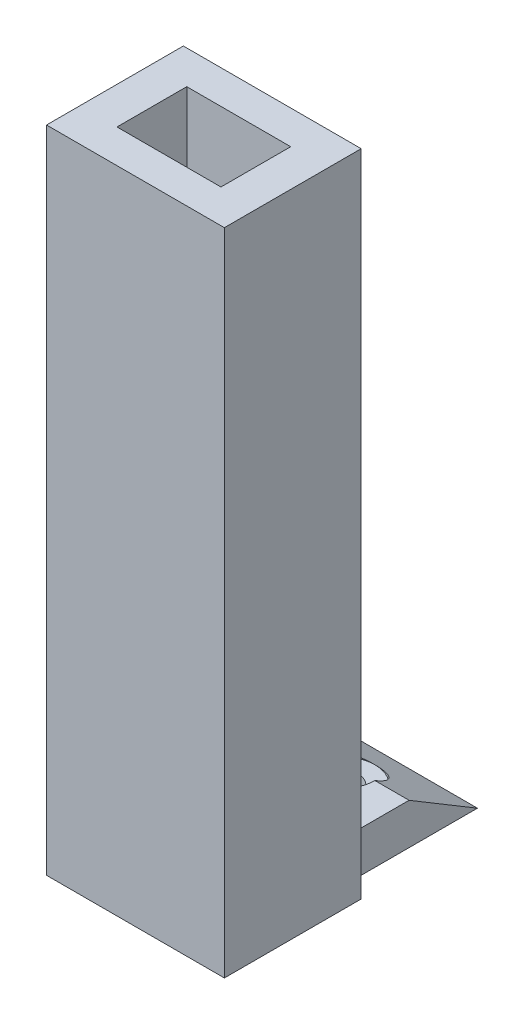
from build123d import *

# Parameters (mm, degrees)
EXTRUDE_1_DEPTH      = 6
SKETCH_2_R           = 2.6
CUT_EXTRUDE_1_DEPTH  = 6
SKETCH_3_R           = 5
CUT_EXTRUDE_2_DEPTH  = 3
SKETCH_4_W           = 26
SKETCH_4_H           = 20
SKETCH_4_W_2         = 15
SKETCH_4_H_2         = 10
EXTRUDE_2_DEPTH      = 89
CUT_EXTRUDE_5_DEPTH  = 5
SKETCH_6_W           = 1
SKETCH_6_H           = 44
EXTRUDE_3_DEPTH      = 15
SKETCH_8_W           = 26
SKETCH_8_H           = 20
SKETCH_8_R           = 2.6
EXTRUDE_4_DEPTH      = 6
SKETCH_9_R           = 5
CUT_EXTRUDE_6_DEPTH  = 3
CUT_EXTRUDE_7_DEPTH  = 30
SKETCH_11_W          = 3
SKETCH_11_H          = 6
CUT_EXTRUDE_8_DEPTH  = 30
CUT_EXTRUDE_10_DEPTH = 45


with BuildPart() as part:
    # 草图1 → 凸台-拉伸1 (new body)
    with BuildSketch(Plane(origin=(0, 0, 0), x_dir=(1, 0, 0), z_dir=(0, 1, 0))):
        Polygon((-10, -10), (10, -10), (13, -10), (13, 10), (10, 10), (-10, 10), (-13, 10), (-13, -10), align=None)
    extrude(amount=EXTRUDE_1_DEPTH)

    # 草图2 → 切除-拉伸1 (cut)
    with BuildSketch(Plane(origin=(0, 6, 0), x_dir=(1, 0, 0), z_dir=(0, 1, 0))):
        with Locations(Location((0, 0, 0), (0, 0, 270))):
            Circle(SKETCH_2_R)
    extrude(amount=-CUT_EXTRUDE_1_DEPTH, mode=Mode.SUBTRACT)

    # 草图3 → 切除-拉伸2 (cut)
    with BuildSketch(Plane(origin=(0, 6, 0), x_dir=(1, 0, 0), z_dir=(0, 1, 0))):
        with Locations(Location((0, 0, 0), (0, 0, 270))):
            Circle(SKETCH_3_R)
    extrude(amount=-CUT_EXTRUDE_2_DEPTH, mode=Mode.SUBTRACT)

    # 草图4 → 凸台-拉伸2 (add)
    with BuildSketch(Plane(origin=(0, 6, 0), x_dir=(1, 0, 0), z_dir=(0, 1, 0))):
        Rectangle(SKETCH_4_W, SKETCH_4_H)
        Rectangle(SKETCH_4_W_2, SKETCH_4_H_2, mode=Mode.SUBTRACT)
    extrude(amount=EXTRUDE_2_DEPTH)

    # 草图5 → 切除-拉伸5 (cut)
    with BuildSketch(Plane(origin=(0, 0, -10), x_dir=(-1, 0, 0), z_dir=(0, 0, -1))):
        Polygon((0, 6), (7.5, 6), (7.5, 15), (7.5, 30), (7.5, 50), (-7.5, 50), (-7.5, 30), (-7.5, 15), (-7.5, 6), align=None)
    extrude(amount=-CUT_EXTRUDE_5_DEPTH, mode=Mode.SUBTRACT)

    # 草图6 → 凸台-拉伸3 (add)
    with BuildSketch(Plane(origin=(0, 0, -10), x_dir=(-1, 0, 0), z_dir=(0, 0, -1))):
        with Locations((7, 28)):
            Rectangle(SKETCH_6_W, SKETCH_6_H)
        with Locations((-7, 28)):
            Rectangle(SKETCH_6_W, SKETCH_6_H)
    extrude(amount=-EXTRUDE_3_DEPTH)

    # 草图8 → 凸台-拉伸4 (add)
    with BuildSketch(Plane.XZ):
        with Locations((0, -20)):
            Rectangle(SKETCH_8_W, SKETCH_8_H)
        with Locations(Location((0, -20, 0), (0, 0, 270))):
            Circle(SKETCH_8_R, mode=Mode.SUBTRACT)
    extrude(amount=-EXTRUDE_4_DEPTH)

    # 草图9 → 切除-拉伸6 (cut)
    with BuildSketch(Plane(origin=(0, 6, 0), x_dir=(1, 0, 0), z_dir=(0, 1, 0))):
        with Locations(Location((0, 20, 0), (0, 0, 270))):
            Circle(SKETCH_9_R)
    extrude(amount=-CUT_EXTRUDE_6_DEPTH, mode=Mode.SUBTRACT)

    # 草图10 → 切除-拉伸7 (cut)
    with BuildSketch(Plane.ZY.offset(13)):
        Polygon((-20, 6), (-30, 0), (-30, 6), align=None)
    extrude(amount=-CUT_EXTRUDE_7_DEPTH, mode=Mode.SUBTRACT)

    # 草图11 → 切除-拉伸8 (cut)
    with BuildSketch(Plane(origin=(0, 0, -10), x_dir=(-1, 0, 0), z_dir=(0, 0, -1))):
        with Locations((-11.5, 3)):
            Rectangle(SKETCH_11_W, SKETCH_11_H)
        with Locations((11.5, 3)):
            Rectangle(SKETCH_11_W, SKETCH_11_H)
    extrude(amount=CUT_EXTRUDE_8_DEPTH, mode=Mode.SUBTRACT)

    # 草图12 → 切除-拉伸10 (cut)
    with BuildSketch(Plane(origin=(0, 95, 0), x_dir=(1, 0, 0), z_dir=(0, 1, 0))):
        Polygon((-7.5, 5.1), (-7.5, 5), (7.5, 5), (7.5, -5), (7.6, -5), (7.6, 5.1), align=None)
        Polygon((-7.6, -5.1), (-7.6, 5.1), (-7.5, 5.1), (-7.5, 5), (-7.5, -5), (7.5, -5), (7.6, -5), (7.6, -5.1), align=None)
    extrude(amount=-CUT_EXTRUDE_10_DEPTH, mode=Mode.SUBTRACT)


solid = part.part
